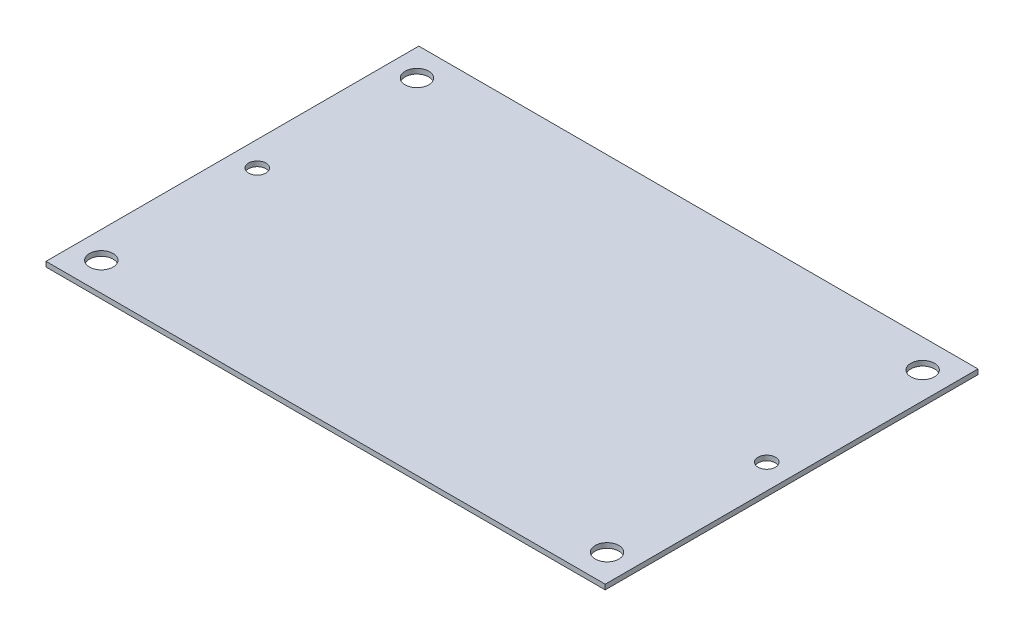
from build123d import *

# Parameters (mm, degrees)
SKETCH_1_W          = 450
SKETCH_1_H          = 300
EXTRUDE_1_DEPTH     = 4
SKETCH_2_R          = 9.5
SKETCH_2_R_2        = 7
CUT_EXTRUDE_1_DEPTH = 10


with BuildPart() as part:
    # Эскиз1 → Бобышка-Вытянуть1 (new body)
    with BuildSketch(Plane(origin=(0, 0, 0), x_dir=(1, 0, 0), z_dir=(0, 1, 0))):
        with Locations((225, 150)):
            Rectangle(SKETCH_1_W, SKETCH_1_H)
    extrude(amount=EXTRUDE_1_DEPTH)

    # Эскиз2 → Вырез-Вытянуть1 (cut)
    with BuildSketch(Plane(origin=(0, 4, 0), x_dir=(1, 0, 0), z_dir=(0, 1, 0))):
        with Locations(Location((21.5, 23, 0), (0, 0, 270))):
            Circle(SKETCH_2_R)
        with Locations(Location((20, 150, 0), (0, 0, 270))):
            Circle(SKETCH_2_R_2)
        with Locations(Location((21.5, 277, 0), (0, 0, 270))):
            Circle(SKETCH_2_R)
        with Locations(Location((428.5, 23, 0), (0, 0, 270))):
            Circle(SKETCH_2_R)
        with Locations(Location((430, 150, 0), (0, 0, 270))):
            Circle(SKETCH_2_R_2)
        with Locations(Location((428.5, 277, 0), (0, 0, 270))):
            Circle(SKETCH_2_R)
    extrude(amount=-CUT_EXTRUDE_1_DEPTH, mode=Mode.SUBTRACT)


solid = part.part
